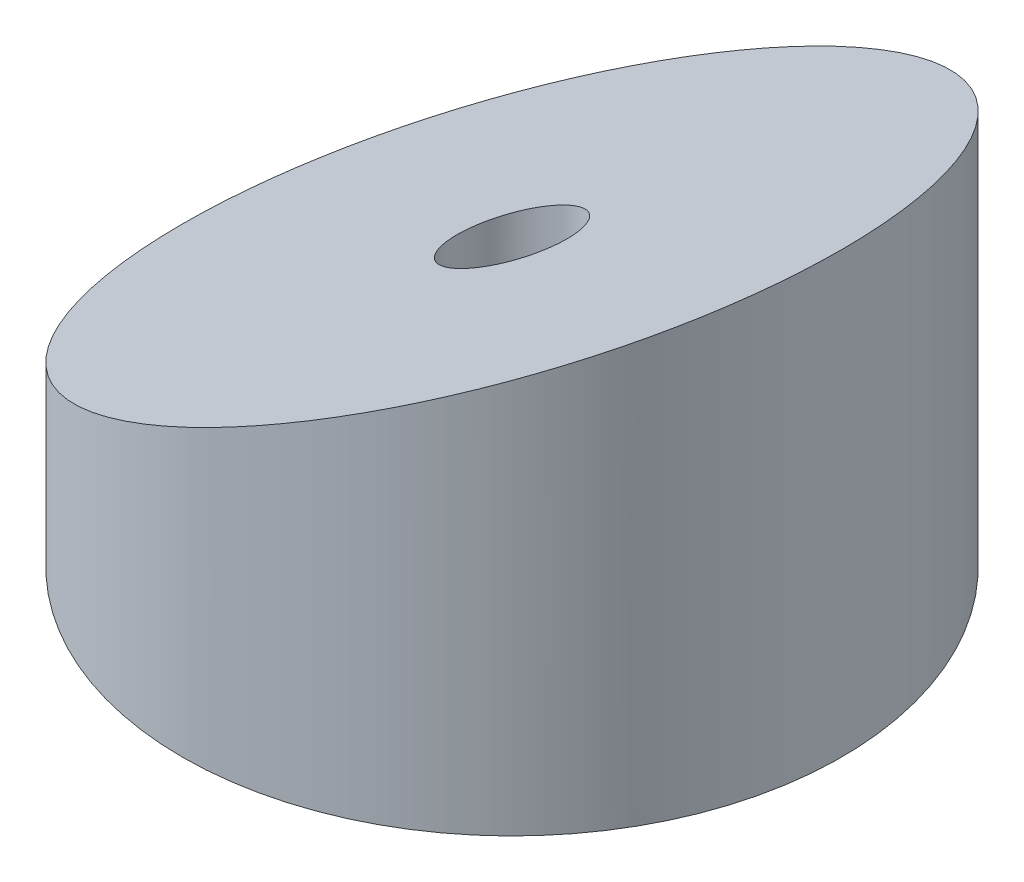
from build123d import *

# Parameters (mm, degrees)
SKETCH1_R               = 120
SKETCH1_R_2             = 20
BOSS_EXTRUDE1_DEPTH     = 80
CUT_EXTRUDE1_DEPTH      = 188.616630393
CUT_EXTRUDE1_DEPTH_BACK = 188.616630393


with BuildPart() as part:
    # Sketch1 → Boss-Extrude1 (new, symmetric)
    with BuildSketch(Plane(origin=(0, 0, 0), x_dir=(1, 0, 0), z_dir=(0, 1, 0))):
        with Locations(Location((0, 0, 0), (0, 0, 270))):
            Circle(SKETCH1_R)
        with Locations(Location((0, 0, 0), (0, 0, 270))):
            Circle(SKETCH1_R_2, mode=Mode.SUBTRACT)
    extrude(amount=BOSS_EXTRUDE1_DEPTH, both=True)

    # Sketch2 → Cut-Extrude1 (cut, two sides: drawn at the far end of the back side and taken through both)
    with BuildSketch(Plane.XY.offset(-CUT_EXTRUDE1_DEPTH_BACK)):
        Polygon((-120, -31.913837957), (-120, 80), (120, 80), align=None)
    extrude(amount=CUT_EXTRUDE1_DEPTH + CUT_EXTRUDE1_DEPTH_BACK, mode=Mode.SUBTRACT)


solid = part.part
